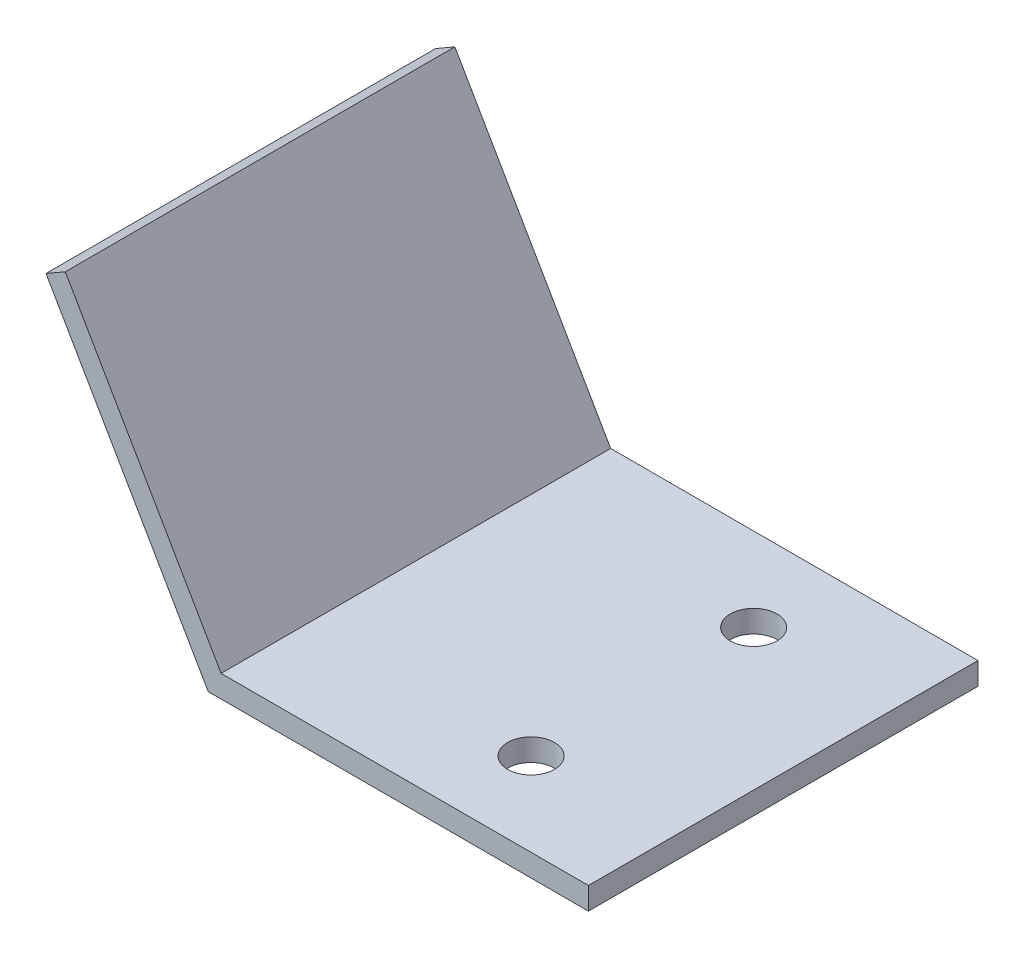
from build123d import *

# Parameters (mm, degrees)
EXTRUDE_3_DEPTH     = 35
SKETCH_3_R          = 2.1
CUT_EXTRUDE_1_DEPTH = 56.502598264
SKETCH_4_R          = 5
CUT_EXTRUDE_2_DEPTH = 1.7


with BuildPart() as part:
    # 草图1 → 凸台-拉伸3 (new body)
    with BuildSketch(Plane.XY):
        Polygon((0, 0), (34.154700538, 0), (34.154700538, 2), (1.154700538, 2), (-12.845299462, 26.248711306), (-14.577350269, 25.248711306), align=None)
    extrude(amount=EXTRUDE_3_DEPTH)

    # 草图3 → 切除-拉伸1 (cut, through all)
    with BuildSketch(Plane.XZ):
        with Locations((21.5, 27.5)):
            Circle(SKETCH_3_R)
        with Locations((21.5, 7.5)):
            Circle(SKETCH_3_R)
    extrude(amount=-CUT_EXTRUDE_1_DEPTH, mode=Mode.SUBTRACT)

    # 草图4 → 切除-拉伸2 (cut)
    with BuildSketch(Plane(origin=(0, 0, 0), x_dir=(0, 0, 1), z_dir=(-0.8660254037844397, -0.499999999999998, 0))):
        with Locations(Location((27.5, 15, 0), (0, 0, 270))):
            Circle(SKETCH_4_R)
        with Locations(Location((7.5, 15, 0), (0, 0, 270))):
            Circle(SKETCH_4_R)
    extrude(amount=-CUT_EXTRUDE_2_DEPTH, mode=Mode.SUBTRACT)


solid = part.part
